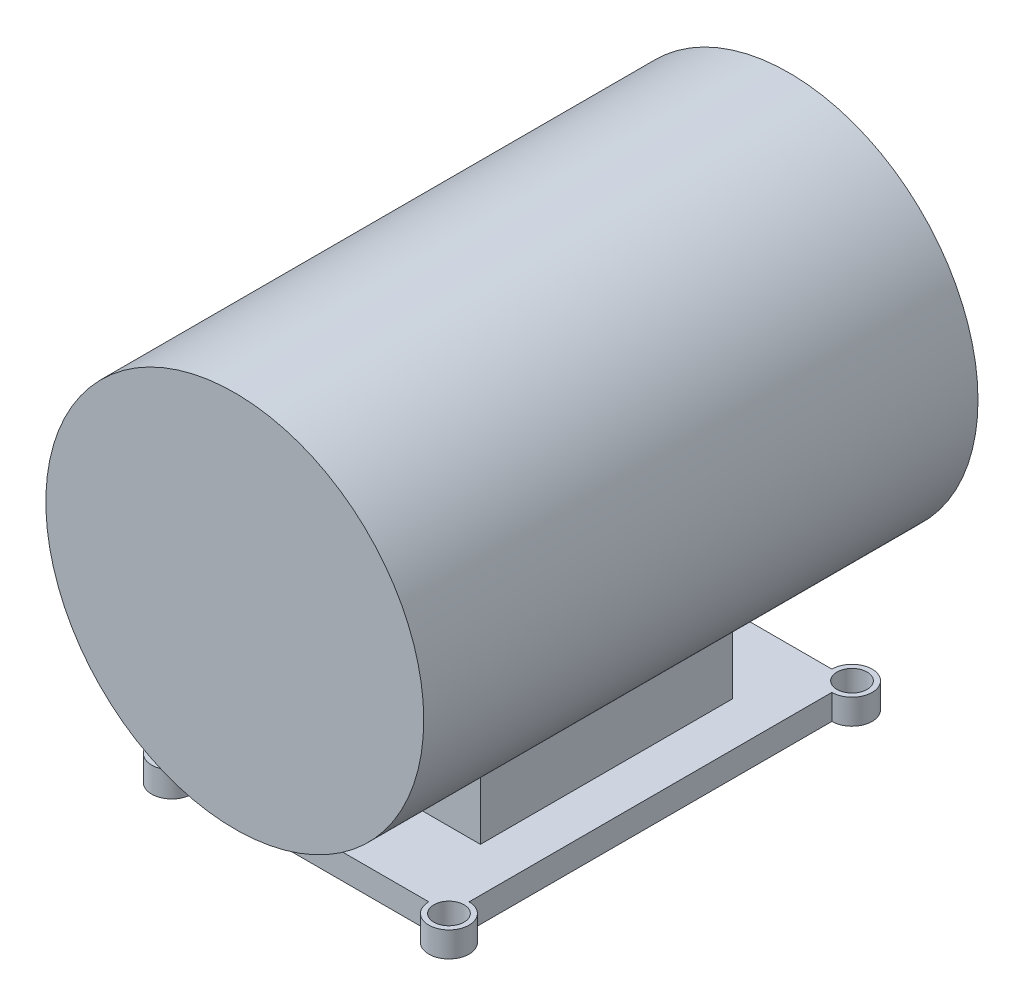
from build123d import *

# Parameters (mm, degrees)
SKETCH1_R                = 6
BOSS_EXTRUDE1_DEPTH      = 5
SKETCH2_W                = 75
SKETCH2_H                = 100
BOSS_EXTRUDE2_DEPTH      = 30
BOSS_EXTRUDE3_DEPTH      = 60
BOSS_EXTRUDE3_DEPTH_BACK = 160
SKETCH3_R                = 75


with BuildPart() as part:
    # Sketch1 → Boss-Extrude1 (new, symmetric)
    with BuildSketch(Plane(origin=(0, 0, 0), x_dir=(1, 0, 0), z_dir=(0, 1, 0))):
        with BuildLine():
            Line((-47, 80), (47, 80))
            ThreePointArc((47, 80), (60.656854249, 85.656854249), (55, 72))
            Line((55, 72), (55, -72))
            ThreePointArc((55, -72), (60.656854249, -85.656854249), (47, -80))
            Line((47, -80), (-47, -80))
            ThreePointArc((-47, -80), (-60.656854249, -85.656854249), (-55, -72))
            Line((-55, -72), (-55, 72))
            ThreePointArc((-55, 72), (-60.656854249, 85.656854249), (-47, 80))
        make_face()
        with Locations(Location((55, 80, 0), (0, 0, 270))):
            Circle(SKETCH1_R, mode=Mode.SUBTRACT)
        with Locations(Location((-55, 80, 0), (0, 0, 270))):
            Circle(SKETCH1_R, mode=Mode.SUBTRACT)
        with Locations(Location((55, -80, 0), (0, 0, 90))):
            Circle(SKETCH1_R, mode=Mode.SUBTRACT)
        with Locations(Location((-55, -80, 0), (0, 0, 90))):
            Circle(SKETCH1_R, mode=Mode.SUBTRACT)
    extrude(amount=BOSS_EXTRUDE1_DEPTH, both=True)

    # Sketch2 → Boss-Extrude2 (add)
    with BuildSketch(Plane(origin=(0, 5, 0), x_dir=(1, 0, 0), z_dir=(0, 1, 0))):
        Rectangle(SKETCH2_W, SKETCH2_H)
    extrude(amount=BOSS_EXTRUDE2_DEPTH)

    # Sketch3 → Boss-Extrude3 (add, two sides: drawn at the far end of the back side and taken through both)
    with BuildSketch(Plane.XY.offset(50).offset(-BOSS_EXTRUDE3_DEPTH_BACK)):
        with Locations((0, 96.5)):
            Circle(SKETCH3_R)
    extrude(amount=BOSS_EXTRUDE3_DEPTH + BOSS_EXTRUDE3_DEPTH_BACK)


solid = part.part
